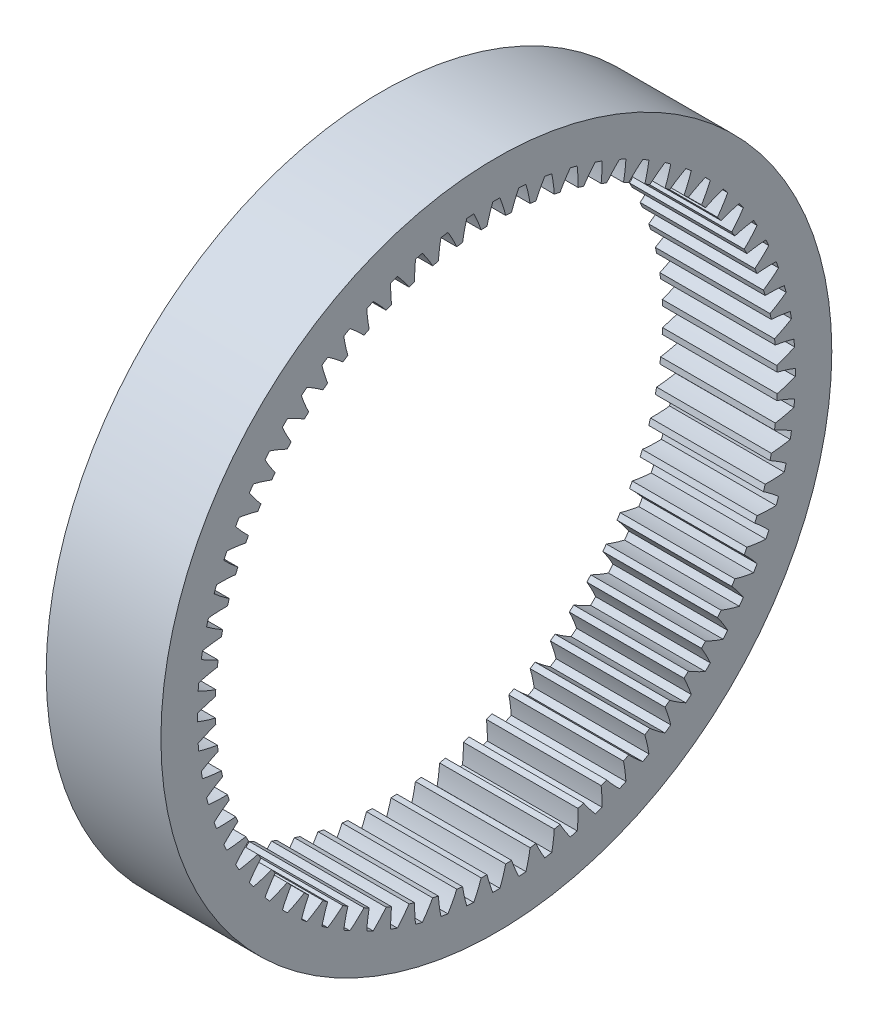
from build123d import *

# Parameters (mm, degrees)
BASPROSKE_W     = 10
BASPROSKE_H     = 4.75
TOOTHCUT_DEPTH  = 43.557314295
TEETHCUTS_COUNT = 72
TEETHCUTS_ANGLE = 355


with BuildPart() as part:
    # BasProSke → Base-Revolve (revolve)
    with BuildSketch(Plane(origin=(0, 0, 0), x_dir=(1, 0, 0), z_dir=(0, 1, 0)), mode=Mode.PRIVATE) as base_revolve_sk:
        with Locations((5, 26.875)):
            Rectangle(BASPROSKE_W, BASPROSKE_H)
    revolve(base_revolve_sk.sketch.rotate(Axis((-10, 0, 0), (1, 0, 0)), 180), axis=Axis((-10, 0, 0), (1, 0, 0)))

    # TooCutSke → ToothCut (cut, through all)
    with BuildSketch(Plane(origin=(0, 0, 0), x_dir=(0, 0, -1), z_dir=(1, 0, 0))):
        with BuildLine():
            ThreePointArc((0.818892938, 24.46089654), (0.591120374, 25.276097907), (0.309130261, 26.07416757))
            ThreePointArc((0.309130261, 26.07416757), (0, 26.076), (-0.309130261, 26.07416757))
            ThreePointArc((-0.309130261, 26.07416757), (-0.591120374, 25.276097907), (-0.818892938, 24.46089654))
            ThreePointArc((-0.818892938, 24.46089654), (0, 24.4746), (0.818892938, 24.46089654))
        make_face()
    toothcut = extrude(amount=TOOTHCUT_DEPTH, mode=Mode.SUBTRACT)

    # TeethCuts: ToothCut ×72 about axis
    teethcuts_axis = Axis((-10, 0, 0), (1, 0, 0))
    for i in range(1, TEETHCUTS_COUNT):
        add(toothcut.rotate(teethcuts_axis, i * TEETHCUTS_ANGLE / (TEETHCUTS_COUNT - 1)), mode=Mode.SUBTRACT)


solid = part.part
